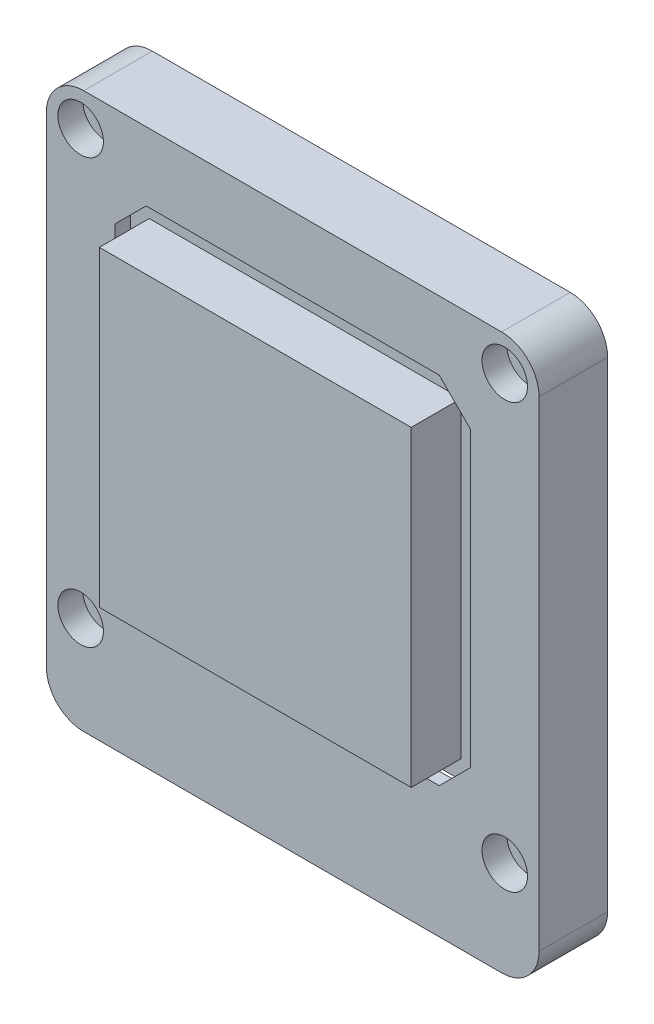
from build123d import *

# Parameters (mm, degrees)
SKETCH1_W           = 28
SKETCH1_H           = 28
BOSS_EXTRUDE1_DEPTH = 8.5
SKETCH4_W           = 28.5
SKETCH4_H           = 28.5
BOSS_EXTRUDE2_DEPTH = 5.5
BOSS_EXTRUDE3_DEPTH = 0.75
SKETCH6_W           = 28
SKETCH6_H           = 28
SKETCH6_W_2         = 25
SKETCH6_H_2         = 25
CUT_EXTRUDE4_DEPTH  = 3
SKETCH7_W           = 28
SKETCH7_H           = 28
SKETCH7_W_2         = 25
SKETCH7_H_2         = 25
CUT_EXTRUDE5_DEPTH  = 4
SKETCH9_R           = 0.95
CUT_EXTRUDE7_DEPTH  = 5.5
SKETCH13_R          = 1.825
CUT_EXTRUDE8_DEPTH  = 2
SKETCH14_W          = 28.5
SKETCH14_H          = 8.710343244
CUT_EXTRUDE9_DEPTH  = 4.5
FILLET2_R           = 3
BOSS_EXTRUDE4_DEPTH = 0.25


with BuildPart() as part:
    # Sketch1 → Boss-Extrude1 (new body)
    with BuildSketch(Plane(origin=(0, 0, 0), x_dir=(0, 1, 0), z_dir=(0, 0, 1))):
        with Locations((14, 14)):
            Rectangle(SKETCH1_W, SKETCH1_H)
    extrude(amount=BOSS_EXTRUDE1_DEPTH)

    # Sketch6 → Cut-Extrude4 (cut)
    with BuildSketch(Plane(origin=(0, 0, 0), x_dir=(1, 0, 0), z_dir=(0, 0, -1))):
        with Locations((-14, -14)):
            Rectangle(SKETCH6_W, SKETCH6_H)
        with Locations((-14, -14)):
            Rectangle(SKETCH6_W_2, SKETCH6_H_2, mode=Mode.SUBTRACT)
    extrude(amount=-CUT_EXTRUDE4_DEPTH, mode=Mode.SUBTRACT)

    # Sketch7 → Cut-Extrude5 (cut)
    with BuildSketch(Plane.XY.offset(8.5)):
        with Locations((-14, 14)):
            Rectangle(SKETCH7_W, SKETCH7_H)
        with Locations((-14, 14)):
            Rectangle(SKETCH7_W_2, SKETCH7_H_2, mode=Mode.SUBTRACT)
    extrude(amount=-CUT_EXTRUDE5_DEPTH, mode=Mode.SUBTRACT)


with BuildPart() as body_2:
    # Sketch4 → Boss-Extrude2 (new body)
    with BuildSketch(Plane(origin=(0, 0, 0), x_dir=(1, 0, 0), z_dir=(0, 0, -1))):
        Polygon((-33.75, 5.75), (-33.75, -33.75), (5.75, -33.75), (5.75, 5.75), (5.75, 10.75), (-33.75, 10.75), align=None)
        with Locations((-14, -14)):
            Rectangle(SKETCH4_W, SKETCH4_H, mode=Mode.SUBTRACT)
    extrude(amount=-BOSS_EXTRUDE2_DEPTH)

    # Sketch5 → Boss-Extrude3 (add)
    with BuildSketch(Plane.XY.offset(5.5)):
        Polygon((-28.25, 25.75), (-25.75, 28.25), (-28.25, 28.25), align=None)
        Polygon((-2.25, 28.25), (0.25, 25.75), (0.25, 28.25), align=None)
        Polygon((-2.25, -0.25), (0.25, 2.25), (0.25, -0.25), align=None)
        Polygon((-25.75, -0.25), (-28.25, 2.25), (-28.25, -0.25), align=None)
    extrude(amount=-BOSS_EXTRUDE3_DEPTH)

    # Sketch9 → Cut-Extrude7 (cut)
    with BuildSketch(Plane(origin=(0, 0, 0), x_dir=(1, 0, 0), z_dir=(0, 0, -1))):
        with Locations(Location((-31, 3, 0), (0, 0, 180))):
            Circle(SKETCH9_R)
        with Locations(Location((3, 3, 0), (0, 0, 180))):
            Circle(SKETCH9_R)
        with Locations(Location((3, -31, 0), (0, 0, 180))):
            Circle(SKETCH9_R)
        with Locations(Location((-31, -31, 0), (0, 0, 180))):
            Circle(SKETCH9_R)
    extrude(amount=-CUT_EXTRUDE7_DEPTH, mode=Mode.SUBTRACT)

    # Sketch13 → Cut-Extrude8 (cut)
    with BuildSketch(Plane.XY.offset(5.5)):
        with Locations((-31, 31)):
            Circle(SKETCH13_R)
        with Locations((3, 31)):
            Circle(SKETCH13_R)
        with Locations((3, -3)):
            Circle(SKETCH13_R)
        with Locations((-31, -3)):
            Circle(SKETCH13_R)
    extrude(amount=-CUT_EXTRUDE8_DEPTH, mode=Mode.SUBTRACT)

    # Sketch14 → Cut-Extrude9 (cut)
    with BuildSketch(Plane(origin=(0, 0, 0), x_dir=(1, 0, 0), z_dir=(0, 0, -1))):
        with Locations((-14, 4.605171622)):
            Rectangle(SKETCH14_W, SKETCH14_H)
    extrude(amount=-CUT_EXTRUDE9_DEPTH, mode=Mode.SUBTRACT)

    # Fillet2
    fillet2_edges = [body_2.edges().sort_by_distance(p)[0] for p in [
        (5.75, 33.75, 2.75),
        (-33.75, 33.75, 2.75),
        (-33.75, -10.75, 2.75),
        (5.75, -10.75, 2.75),
    ]]
    fillet(fillet2_edges, radius=FILLET2_R)

    # Sketch15 → Boss-Extrude4 (add)
    with BuildSketch(Plane(origin=(0, 0, 4.75), x_dir=(1, 0, 0), z_dir=(0, 0, -1))):
        Polygon((0.25, 0.25), (-2.25, 0.25), (0.25, -2.25), align=None)
        Polygon((-28.25, 0.25), (-28.25, -2.25), (-25.75, 0.25), align=None)
        Polygon((-28.25, -28.25), (-25.75, -28.25), (-28.25, -25.75), align=None)
        Polygon((0.25, -28.25), (0.25, -25.75), (-2.25, -28.25), align=None)
    extrude(amount=BOSS_EXTRUDE4_DEPTH)


solid = Compound([part.part, body_2.part])
